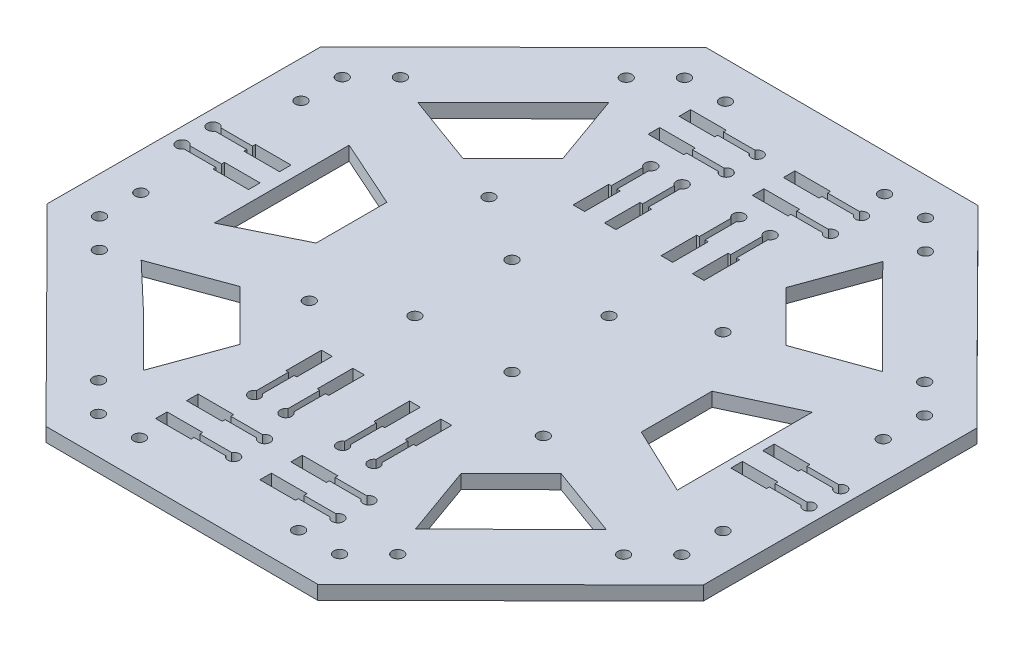
from build123d import *

# Parameters (mm, degrees)
BOSS_EXTRUDE1_DEPTH        = 4.318
CUT_EXTRUDE1_DEPTH         = 12.7
F_15_0_14_DIAMETER_HOLE1_D = 3.556
F_15_0_14_DIAMETER_HOLE3_D = 3.556
F_15_0_14_DIAMETER_HOLE4_D = 3.556
F_15_0_14_DIAMETER_HOLE5_D = 3.556
CUT_EXTRUDE2_DEPTH         = 10
CUT_EXTRUDE3_DEPTH         = 10


with BuildPart() as part:
    # Sketch1 → Boss-Extrude1 (new body)
    with BuildSketch(Plane(origin=(0, 0, 0), x_dir=(1, 0, 0), z_dir=(0, 1, 0))):
        Polygon((-101.734861683, -41.757025965), (-42.410734357, -101.464086802), (41.757025965, -101.734861683), (101.464086802, -42.410734357), (101.734861683, 41.757025965), (42.410734357, 101.464086802), (-41.757025965, 101.734861683), (-101.464086802, 42.410734357), align=None)
    extrude(amount=BOSS_EXTRUDE1_DEPTH)

    # Sketch6 → Cut-Extrude1 (cut)
    with BuildSketch(Plane(origin=(0, 4.318, 0), x_dir=(1, 0, 0), z_dir=(0, 1, 0))):
        Polygon((-71.63902199, 42.550988515), (-56.864098396, 57.231152574), (-42.089174802, 71.911316632), (-34.257082159, 49.974181796), (-42.004907946, 42.276046985), (-49.72792821, 34.553026721), align=None)
        Polygon((71.63902199, -42.550988515), (56.864098396, -57.231152574), (42.089174802, -71.911316632), (34.257082159, -49.974181796), (42.004907946, -42.276046985), (49.752733734, -34.577912173), align=None)
        Polygon((42.697293757, 71.784388897), (57.377457815, 57.009465303), (72.088409596, 42.33049548), (50.120487037, 34.402449066), (42.422352226, 42.150274854), (34.724217415, 49.898100641), align=None)
        Polygon((-42.368336547, -71.457541467), (-57.048500606, -56.682617873), (-72.149390573, -42.337977544), (-49.816415281, -34.100407159), (-42.093395016, -41.823427424), (-34.370374752, -49.546447688), align=None)
        Polygon((72.088409596, -0.231914577), (72.088409596, 20.595875803), (51.006409596, 10.757908019), (51.006409596, -0.164091981), (51.006409596, -11.086091981), (72.088409596, -21.060124197), align=None)
        Polygon((-70.80992821, 20.525505482), (-70.80992821, -21.130494518), (-49.72792821, -10.762021003), (-49.72792821, 0.159978997), (-49.72792821, 11.081978997), align=None)
    extrude(amount=-CUT_EXTRUDE1_DEPTH, mode=Mode.SUBTRACT)

    # #15 (0.14) Diameter Hole1 (through all)
    with Locations(Plane(origin=(-37.639526742, 4.318, 90.049377036), x_dir=(0, 0, 1), z_dir=(0, 1, 0))):
        with Locations((0, 0), (0.240312708, 74.698887286), (-52.409850294, 127.688903778), (-127.10873758, 127.929216486), (-180.098754072, 75.279053484), (-180.33906678, 0.580166198), (-127.688903778, -52.409850294), (-52.990016492, -52.650163002)):
            Hole(F_15_0_14_DIAMETER_HOLE1_D / 2)

    # #15 (0.14) Diameter Hole3 (through all)
    with Locations(Plane(origin=(-90.248832758, 4.318, 24.359360544), x_dir=(0, 0, 1), z_dir=(0, 1, 0))):
        with Locations((0, 0), (21.709099753, 8.910462562), (56.68091674, 43.657986468), (65.730873478, 65.309306016), (65.889472214, 114.608193302), (56.979009652, 136.317293055), (22.231485746, 171.289110042), (0.580166198, 180.33906678), (-48.718721088, 180.497665516), (-70.427820841, 171.587202954), (-105.399637828, 136.839679048), (-114.449594566, 115.1883595), (-114.608193302, 65.889472214), (-105.69773074, 44.180372461), (-70.950206834, 9.208555474), (-49.298887286, 0.158598736)):
            Hole(F_15_0_14_DIAMETER_HOLE3_D / 2)

    # #15 (0.14) Diameter Hole4 (through all)
    with Locations(Plane(origin=(-14.986, 4.318, -14.986), x_dir=(0, 0, 1), z_dir=(0, 1, 0))):
        with Locations((0, 0), (0, 29.972), (29.972, 29.972), (29.972, 0)):
            Hole(F_15_0_14_DIAMETER_HOLE4_D / 2)

    # #15 (0.14) Diameter Hole5 (through all)
    with Locations(Plane(origin=(-35.335317857, 4.318, -28.22473094), x_dir=(0, 0, 1), z_dir=(0, 1, 0))):
        with Locations((0, 0), (55.471221795, 0), (55.471221795, 72.247883996), (0, 72.247883996)):
            Hole(F_15_0_14_DIAMETER_HOLE5_D / 2)

    # Sketch27 → Cut-Extrude2 (cut)
    with BuildSketch(Plane(origin=(0, 4.318, 0), x_dir=(1, 0, 0), z_dir=(0, 1, 0))):
        with BuildLine():
            Line((-27.580374752, -72.904086802), (-16.580374752, -72.904086802))
            Line((-16.580374752, -72.904086802), (-16.580374752, -72.014484845))
            Line((-16.580374752, -72.014484845), (-6.801785049, -72.014484845))
            ThreePointArc((-6.801785049, -72.014484845), (-3.480374752, -71.124285823), (-6.801785049, -70.234086802))
            Line((-6.801785049, -70.234086802), (-16.580374752, -70.234086802))
            Line((-16.580374752, -70.234086802), (-16.580374752, -69.344086802))
            Line((-16.580374752, -69.344086802), (-27.580374752, -69.344086802))
            Line((-27.580374752, -69.344086802), (-27.580374752, -72.904086802))
        make_face()
        with BuildLine():
            Line((-27.580374752, -82.464086802), (-16.580374752, -82.464086802))
            Line((-16.580374752, -82.464086802), (-16.580374752, -81.574484845))
            Line((-16.580374752, -81.574484845), (-6.801785049, -81.574484845))
            ThreePointArc((-6.801785049, -81.574484845), (-3.480374752, -80.684285823), (-6.801785049, -79.794086802))
            Line((-6.801785049, -79.794086802), (-16.580374752, -79.794086802))
            Line((-16.580374752, -79.794086802), (-16.580374752, -78.904086802))
            Line((-16.580374752, -78.904086802), (-27.580374752, -78.904086802))
            Line((-27.580374752, -78.904086802), (-27.580374752, -82.464086802))
        make_face()
        with BuildLine():
            Line((4.885579183, -73.174861683), (15.885579183, -73.174861683))
            Line((15.885579183, -73.174861683), (15.885579183, -72.285259727))
            Line((15.885579183, -72.285259727), (25.664168887, -72.285259727))
            ThreePointArc((25.664168887, -72.285259727), (28.985579183, -71.395060705), (25.664168887, -70.504861683))
            Line((25.664168887, -70.504861683), (15.885579183, -70.504861683))
            Line((15.885579183, -70.504861683), (15.885579183, -69.614861683))
            Line((15.885579183, -69.614861683), (4.885579183, -69.614861683))
            Line((4.885579183, -69.614861683), (4.885579183, -73.174861683))
        make_face()
        with BuildLine():
            Line((4.880681084, -82.734861683), (15.880681084, -82.734861683))
            Line((15.880681084, -82.734861683), (15.880681084, -81.845259727))
            Line((15.880681084, -81.845259727), (25.659270788, -81.845259727))
            ThreePointArc((25.659270788, -81.845259727), (28.980681084, -80.955060705), (25.659270788, -80.064861683))
            Line((25.659270788, -80.064861683), (15.880681084, -80.064861683))
            Line((15.880681084, -80.064861683), (15.880681084, -79.174861683))
            Line((15.880681084, -79.174861683), (4.880681084, -79.174861683))
            Line((4.880681084, -79.174861683), (4.880681084, -82.734861683))
        make_face()
        with BuildLine():
            Line((-74.460068194, -3.323096636), (-85.460068194, -3.323096636))
            Line((-85.460068194, -3.323096636), (-85.460068194, -4.213096636))
            Line((-85.460068194, -4.213096636), (-95.238657898, -4.213096636))
            ThreePointArc((-95.238657898, -4.213096636), (-98.560068194, -5.103295658), (-95.238657898, -5.993494679))
            Line((-95.238657898, -5.993494679), (-85.452386649, -5.993494679))
            Line((-85.452386649, -5.993494679), (-85.452386649, -6.883494679))
            Line((-85.452386649, -6.883494679), (-74.460068194, -6.883494679))
            Line((-74.460068194, -6.883494679), (-74.460068194, -3.323096636))
        make_face()
        with BuildLine():
            Line((-27.580374752, 79.174861683), (-16.580374752, 79.174861683))
            Line((-16.580374752, 79.174861683), (-16.580374752, 80.06446364))
            Line((-16.580374752, 80.06446364), (-6.801785049, 80.06446364))
            ThreePointArc((-6.801785049, 80.06446364), (-3.480374752, 80.954662662), (-6.801785049, 81.844861683))
            Line((-6.801785049, 81.844861683), (-16.580374752, 81.844861683))
            Line((-16.580374752, 81.844861683), (-16.580374752, 82.734861683))
            Line((-16.580374752, 82.734861683), (-27.580374752, 82.734861683))
            Line((-27.580374752, 82.734861683), (-27.580374752, 79.174861683))
        make_face()
        with BuildLine():
            Line((-27.580374752, 69.614861683), (-16.580374752, 69.614861683))
            Line((-16.580374752, 69.614861683), (-16.580374752, 70.50446364))
            Line((-16.580374752, 70.50446364), (-6.801785049, 70.50446364))
            ThreePointArc((-6.801785049, 70.50446364), (-3.480374752, 71.394662662), (-6.801785049, 72.284861683))
            Line((-6.801785049, 72.284861683), (-16.580374752, 72.284861683))
            Line((-16.580374752, 72.284861683), (-16.580374752, 73.174861683))
            Line((-16.580374752, 73.174861683), (-27.580374752, 73.174861683))
            Line((-27.580374752, 73.174861683), (-27.580374752, 69.614861683))
        make_face()
        with BuildLine():
            Line((4.885579183, 78.904086802), (15.885579183, 78.904086802))
            Line((15.885579183, 78.904086802), (15.885579183, 79.793688758))
            Line((15.885579183, 79.793688758), (25.664168887, 79.793688758))
            ThreePointArc((25.664168887, 79.793688758), (28.985579183, 80.68388778), (25.664168887, 81.574086802))
            Line((25.664168887, 81.574086802), (15.885579183, 81.574086802))
            Line((15.885579183, 81.574086802), (15.885579183, 82.464086802))
            Line((15.885579183, 82.464086802), (4.885579183, 82.464086802))
            Line((4.885579183, 82.464086802), (4.885579183, 78.904086802))
        make_face()
        with BuildLine():
            Line((4.880681084, 69.344086802), (15.880681084, 69.344086802))
            Line((15.880681084, 69.344086802), (15.880681084, 70.233688758))
            Line((15.880681084, 70.233688758), (25.659270788, 70.233688758))
            ThreePointArc((25.659270788, 70.233688758), (28.980681084, 71.12388778), (25.659270788, 72.014086802))
            Line((25.659270788, 72.014086802), (15.880681084, 72.014086802))
            Line((15.880681084, 72.014086802), (15.880681084, 72.904086802))
            Line((15.880681084, 72.904086802), (4.880681084, 72.904086802))
            Line((4.880681084, 72.904086802), (4.880681084, 69.344086802))
        make_face()
        with BuildLine():
            Line((74.734861683, 2.674265643), (85.734861683, 2.674265643))
            Line((85.734861683, 2.674265643), (85.734861683, 3.561627922))
            Line((85.734861683, 3.561627922), (95.513451387, 3.561627922))
            ThreePointArc((95.513451387, 3.561627922), (98.834861683, 4.451826944), (95.513451387, 5.342025965))
            Line((95.513451387, 5.342025965), (85.734861683, 5.342025965))
            Line((85.734861683, 5.342025965), (85.734861683, 6.232025965))
            Line((85.734861683, 6.232025965), (74.734861683, 6.232025965))
            Line((74.734861683, 6.232025965), (74.734861683, 2.674265643))
        make_face()
        with BuildLine():
            Line((74.464086802, -6.885734357), (85.464086802, -6.885734357))
            Line((85.464086802, -6.885734357), (85.464086802, -5.9961324))
            Line((85.464086802, -5.9961324), (95.242676505, -5.9961324))
            ThreePointArc((95.242676505, -5.9961324), (98.564086802, -5.105933379), (95.242676505, -4.215734357))
            Line((95.242676505, -4.215734357), (85.464086802, -4.215734357))
            Line((85.464086802, -4.215734357), (85.464086802, -3.325734357))
            Line((85.464086802, -3.325734357), (74.464086802, -3.325734357))
            Line((74.464086802, -3.325734357), (74.464086802, -6.885734357))
        make_face()
        with BuildLine():
            Line((-74.452386649, 6.234663686), (-85.452386649, 6.234663686))
            Line((-85.452386649, 6.234663686), (-85.452386649, 5.344663686))
            Line((-85.452386649, 5.344663686), (-95.233759798, 5.344663686))
            ThreePointArc((-95.233759798, 5.344663686), (-98.555170095, 4.454464665), (-95.233759798, 3.564265643))
            Line((-95.233759798, 3.564265643), (-85.452386649, 3.564265643))
            Line((-85.452386649, 3.564265643), (-85.452386649, 2.674265643))
            Line((-85.452386649, 2.674265643), (-74.452386649, 2.674265643))
            Line((-74.452386649, 2.674265643), (-74.452386649, 6.234663686))
        make_face()
    extrude(amount=-CUT_EXTRUDE2_DEPTH, mode=Mode.SUBTRACT)

    # Sketch26 → Cut-Extrude3 (cut)
    with BuildSketch(Plane(origin=(0, 4.318, 0), x_dir=(1, 0, 0), z_dir=(0, 1, 0))):
        with BuildLine():
            Line((-10.580374752, -38.555819238), (-10.580374752, -49.555819238))
            Line((-10.580374752, -49.555819238), (-9.800374752, -49.555819238))
            Line((-9.800374752, -49.555819238), (-9.800374752, -59.334408941))
            ThreePointArc((-9.800374752, -59.334408941), (-8.910175731, -62.655819238), (-8.019976709, -59.334408941))
            Line((-8.019976709, -59.334408941), (-8.019976709, -49.555819238))
            Line((-8.019976709, -49.555819238), (-7.019976709, -49.555819238))
            Line((-7.019976709, -49.555819238), (-7.019976709, -38.555819238))
            Line((-7.019976709, -38.555819238), (-10.580374752, -38.555819238))
        make_face()
        with BuildLine():
            Line((-20.260374752, -38.555819238), (-20.260374752, -49.555819238))
            Line((-20.260374752, -49.555819238), (-19.480374752, -49.555819238))
            Line((-19.480374752, -49.555819238), (-19.480374752, -59.334408941))
            ThreePointArc((-19.480374752, -59.334408941), (-18.590175731, -62.655819238), (-17.699976709, -59.334408941))
            Line((-17.699976709, -59.334408941), (-17.699976709, -49.555819238))
            Line((-17.699976709, -49.555819238), (-16.919976709, -49.555819238))
            Line((-16.919976709, -49.555819238), (-16.919976709, -38.555819238))
            Line((-16.919976709, -38.555819238), (-20.260374752, -38.555819238))
        make_face()
        with BuildLine():
            Line((16.591274467, -38.555819238), (16.591274467, -49.555819238))
            Line((16.591274467, -49.555819238), (17.371274467, -49.555819238))
            Line((17.371274467, -49.555819238), (17.371274467, -59.334408941))
            ThreePointArc((17.371274467, -59.334408941), (18.261473489, -62.655819238), (19.15167251, -59.334408941))
            Line((19.15167251, -59.334408941), (19.15167251, -49.555819238))
            Line((19.15167251, -49.555819238), (19.93167251, -49.555819238))
            Line((19.93167251, -49.555819238), (19.93167251, -38.555819238))
            Line((19.93167251, -38.555819238), (16.591274467, -38.555819238))
        make_face()
        with BuildLine():
            Line((6.9116337, -38.555819238), (6.9116337, -49.555819238))
            Line((6.9116337, -49.555819238), (7.6916337, -49.555819238))
            Line((7.6916337, -49.555819238), (7.6916337, -59.334408941))
            ThreePointArc((7.6916337, -59.334408941), (8.581832721, -62.655819238), (9.472031743, -59.334408941))
            Line((9.472031743, -59.334408941), (9.472031743, -49.555819238))
            Line((9.472031743, -49.555819238), (10.252031743, -49.555819238))
            Line((10.252031743, -49.555819238), (10.252031743, -38.555819238))
            Line((10.252031743, -38.555819238), (6.9116337, -38.555819238))
        make_face()
        with BuildLine():
            Line((10.471274467, 39.124861683), (10.471274467, 50.124861683))
            Line((10.471274467, 50.124861683), (9.47167251, 50.124861683))
            Line((9.47167251, 50.124861683), (9.47167251, 59.903451387))
            ThreePointArc((9.47167251, 59.903451387), (8.581473489, 63.224861683), (7.691274467, 59.903451387))
            Line((7.691274467, 59.903451387), (7.691274467, 50.124861683))
            Line((7.691274467, 50.124861683), (6.911274467, 50.124861683))
            Line((6.911274467, 50.124861683), (6.911274467, 39.124861683))
            Line((6.911274467, 39.124861683), (10.471274467, 39.124861683))
        make_face()
        with BuildLine():
            Line((20.151274467, 39.124861683), (20.151274467, 50.124861683))
            Line((20.151274467, 50.124861683), (19.15167251, 50.124861683))
            Line((19.15167251, 50.124861683), (19.15167251, 59.903451387))
            ThreePointArc((19.15167251, 59.903451387), (18.261473489, 63.224861683), (17.371274467, 59.903451387))
            Line((17.371274467, 59.903451387), (17.371274467, 50.124861683))
            Line((17.371274467, 50.124861683), (16.591274467, 50.124861683))
            Line((16.591274467, 50.124861683), (16.591274467, 39.124861683))
            Line((16.591274467, 39.124861683), (20.151274467, 39.124861683))
        make_face()
        with BuildLine():
            Line((-16.700374752, 39.124861683), (-16.700374752, 50.124861683))
            Line((-16.700374752, 50.124861683), (-17.699976709, 50.124861683))
            Line((-17.699976709, 50.124861683), (-17.699976709, 59.903451387))
            ThreePointArc((-17.699976709, 59.903451387), (-18.590175731, 63.224861683), (-19.480374752, 59.903451387))
            Line((-19.480374752, 59.903451387), (-19.480374752, 50.124861683))
            Line((-19.480374752, 50.124861683), (-20.260374752, 50.124861683))
            Line((-20.260374752, 50.124861683), (-20.260374752, 39.124861683))
            Line((-20.260374752, 39.124861683), (-16.700374752, 39.124861683))
        make_face()
        with BuildLine():
            Line((-7.020733985, 39.124861683), (-7.020733985, 50.124861683))
            Line((-7.020733985, 50.124861683), (-8.020335942, 50.124861683))
            Line((-8.020335942, 50.124861683), (-8.020335942, 59.903451387))
            ThreePointArc((-8.020335942, 59.903451387), (-8.910534963, 63.224861683), (-9.800733985, 59.903451387))
            Line((-9.800733985, 59.903451387), (-9.800733985, 50.124861683))
            Line((-9.800733985, 50.124861683), (-10.580733985, 50.124861683))
            Line((-10.580733985, 50.124861683), (-10.580733985, 39.124861683))
            Line((-10.580733985, 39.124861683), (-7.020733985, 39.124861683))
        make_face()
    extrude(amount=-CUT_EXTRUDE3_DEPTH, mode=Mode.SUBTRACT)


solid = part.part
